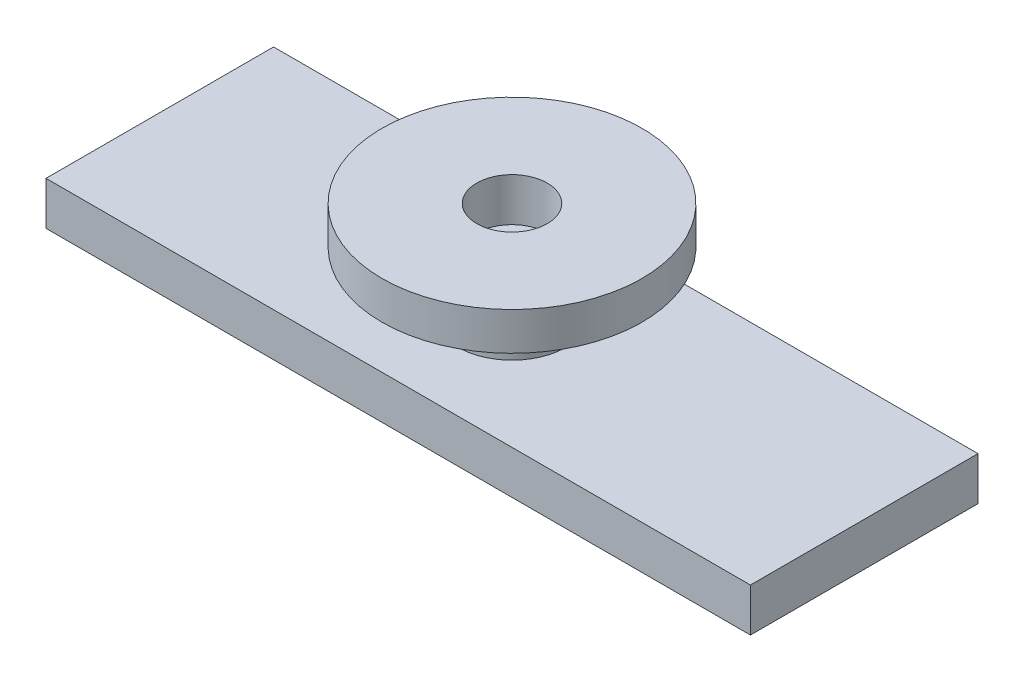
from build123d import *

# Parameters (mm, degrees)
ESBO_O1_W                = 65
ESBO_O1_H                = 21
RESSALTO_EXTRUS_O3_DEPTH = 4
ESBO_O5_R                = 6.5
CORTE_EXTRUS_O2_DEPTH    = 3
ESBO_O6_R                = 3
CORTE_EXTRUS_O3_DEPTH    = 4
ESBO_O7_R                = 5
RESSALTO_EXTRUS_O4_DEPTH = 5.5
ESBO_O8_R                = 3.25
CORTE_EXTRUS_O4_DEPTH    = 0.5
ESBO_O10_R               = 3
CORTE_EXTRUS_O5_DEPTH    = 3
RESSALTO_EXTRUS_O5_START = 3.5
ESBO_O11_R               = 12
ESBO_O11_R_2             = 3.25
RESSALTO_EXTRUS_O5_DEPTH = 3.5
ESBO_O12_R               = 1.5
CORTE_EXTRUS_O6_DEPTH    = 5


with BuildPart() as part:
    # Esboço1 → Ressalto-extrusão3 (new body)
    with BuildSketch(Plane(origin=(0, 0, 0), x_dir=(1, 0, 0), z_dir=(0, 1, 0))):
        Rectangle(ESBO_O1_W, ESBO_O1_H)
    extrude(amount=RESSALTO_EXTRUS_O3_DEPTH)

    # Esboço5 → Corte-extrusão2 (cut)
    with BuildSketch(Plane.XZ):
        with Locations(Location((0, 0, 0), (0, 0, 270))):
            Circle(ESBO_O5_R)
    extrude(amount=-CORTE_EXTRUS_O2_DEPTH, mode=Mode.SUBTRACT)

    # Esboço6 → Corte-extrusão3 (cut)
    with BuildSketch(Plane.XZ.offset(-3)):
        with Locations(Location((0, 0, 0), (0, 0, 270))):
            Circle(ESBO_O6_R)
    extrude(amount=-CORTE_EXTRUS_O3_DEPTH, mode=Mode.SUBTRACT)

    # Esboço7 → Ressalto-extrusão4 (add)
    with BuildSketch(Plane(origin=(0, 4, 0), x_dir=(1, 0, 0), z_dir=(0, 1, 0))):
        with Locations(Location((0, 0, 0), (0, 0, 90))):
            Circle(ESBO_O7_R)
    extrude(amount=RESSALTO_EXTRUS_O4_DEPTH)

    # Esboço8 → Corte-extrusão4 (cut)
    with BuildSketch(Plane(origin=(0, 9.5, 0), x_dir=(1, 0, 0), z_dir=(0, 1, 0))):
        with Locations(Location((0, 0, 0), (0, 0, 270))):
            Circle(ESBO_O8_R)
    extrude(amount=-CORTE_EXTRUS_O4_DEPTH, mode=Mode.SUBTRACT)

    # Esboço10 → Corte-extrusão5 (cut)
    with BuildSketch(Plane.XZ.offset(-4)):
        with Locations(Location((0, 0, 0), (0, 0, 270))):
            Circle(ESBO_O10_R)
    extrude(amount=-CORTE_EXTRUS_O5_DEPTH, mode=Mode.SUBTRACT)

    # Esboço11 → Ressalto-extrusão5 (add)
    with BuildSketch(Plane(origin=(0, 9.5, 0), x_dir=(1, 0, 0), z_dir=(0, 1, 0)).offset(RESSALTO_EXTRUS_O5_START)):
        with Locations(Location((0, 0, 0), (0, 0, 270))):
            Circle(ESBO_O11_R)
        with Locations(Location((0, 0, 0), (0, 0, 270))):
            Circle(ESBO_O11_R_2, mode=Mode.SUBTRACT)
    extrude(amount=-RESSALTO_EXTRUS_O5_DEPTH)

    # Esboço12 → Corte-extrusão6 (cut)
    with BuildSketch(Plane(origin=(0, 9, 0), x_dir=(1, 0, 0), z_dir=(0, 1, 0))):
        with Locations(Location((0, 0, 0), (0, 0, 270))):
            Circle(ESBO_O12_R)
    extrude(amount=-CORTE_EXTRUS_O6_DEPTH, mode=Mode.SUBTRACT)


solid = part.part
